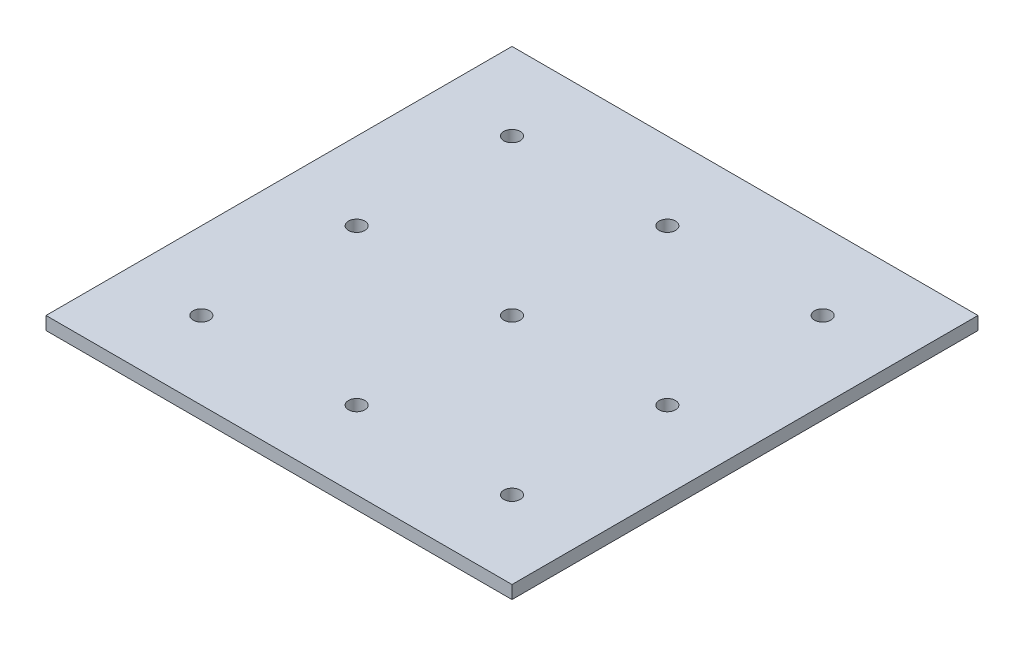
from build123d import *

# Parameters (mm, degrees)
SKETCH1_W           = 57
SKETCH1_H           = 57
SKETCH1_R           = 1
BOSS_EXTRUDE1_DEPTH = 1.6


with BuildPart() as part:
    # Sketch1 → Boss-Extrude1 (new body)
    with BuildSketch(Plane(origin=(0, 0, 0), x_dir=(1, 0, 0), z_dir=(0, 1, 0))):
        Rectangle(SKETCH1_W, SKETCH1_H)
        with Locations(Location((0, -19, 0), (0, 0, 270))):
            Circle(SKETCH1_R, mode=Mode.SUBTRACT)
        with Locations(Location((19, -19, 0), (0, 0, 270))):
            Circle(SKETCH1_R, mode=Mode.SUBTRACT)
        with Locations(Location((-19, -19, 0), (0, 0, 270))):
            Circle(SKETCH1_R, mode=Mode.SUBTRACT)
        with Locations(Location((0, 19, 0), (0, 0, 270))):
            Circle(SKETCH1_R, mode=Mode.SUBTRACT)
        with Locations(Location((19, 19, 0), (0, 0, 270))):
            Circle(SKETCH1_R, mode=Mode.SUBTRACT)
        with Locations(Location((-19, 19, 0), (0, 0, 270))):
            Circle(SKETCH1_R, mode=Mode.SUBTRACT)
        with Locations(Location((19, 0, 0), (0, 0, 270))):
            Circle(SKETCH1_R, mode=Mode.SUBTRACT)
        with Locations(Location((-19, 0, 0), (0, 0, 270))):
            Circle(SKETCH1_R, mode=Mode.SUBTRACT)
        with Locations(Location((0, 0, 0), (0, 0, 270))):
            Circle(SKETCH1_R, mode=Mode.SUBTRACT)
    extrude(amount=BOSS_EXTRUDE1_DEPTH)


solid = part.part
